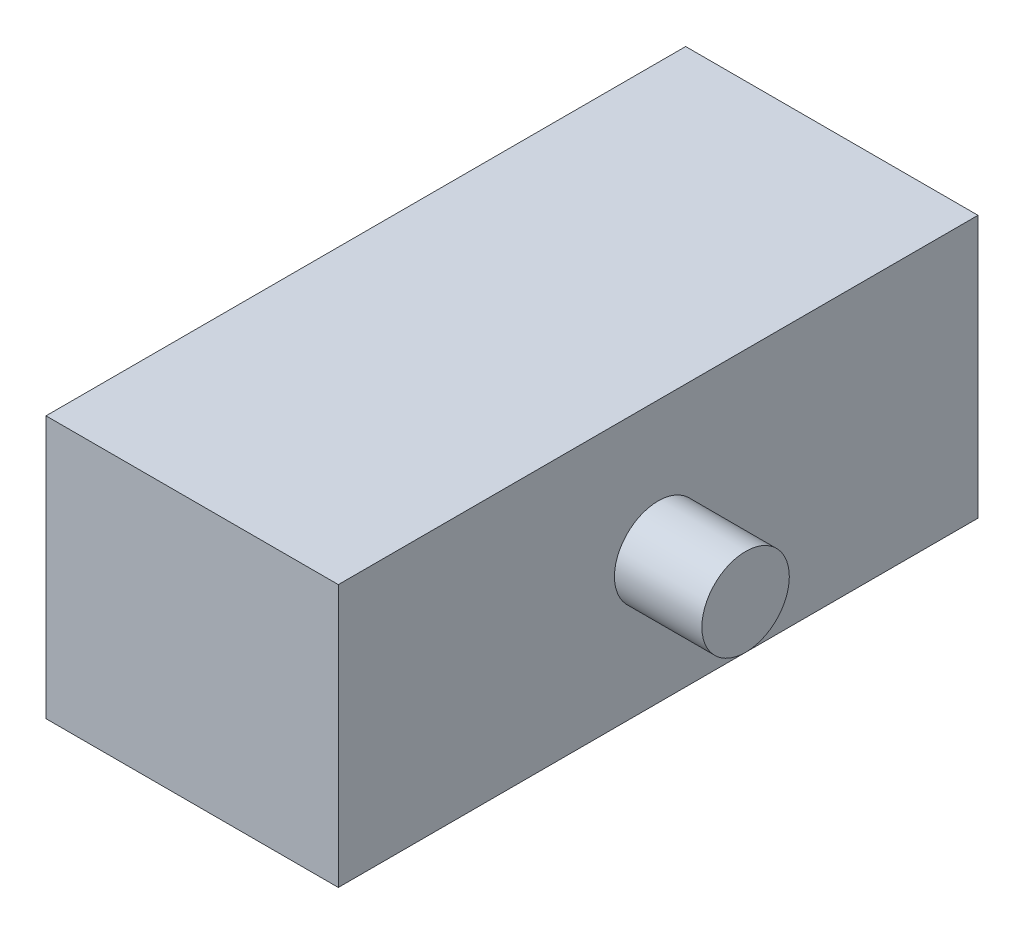
from build123d import *

# Parameters (mm, degrees)
SKETCH_1_W      = 16.716829108
SKETCH_1_H      = 36.578468476
EXTRUDE_1_DEPTH = 15
SKETCH_2_R      = 2.5
EXTRUDE_2_DEPTH = 5


with BuildPart() as part:
    # 草图1 → 凸台-拉伸1 (new body)
    with BuildSketch(Plane(origin=(0, 0, 0), x_dir=(1, 0, 0), z_dir=(0, 1, 0))):
        Rectangle(SKETCH_1_W, SKETCH_1_H)
    extrude(amount=EXTRUDE_1_DEPTH)

    # 草图2 → 凸台-拉伸2 (add)
    with BuildSketch(Plane(origin=(8.358414554, 0, 0), x_dir=(0, 0, -1), z_dir=(1, 0, 0))):
        with Locations(Location((0, 7.5, 0), (0, 0, 180))):
            Circle(SKETCH_2_R)
    extrude(amount=EXTRUDE_2_DEPTH)


solid = part.part
